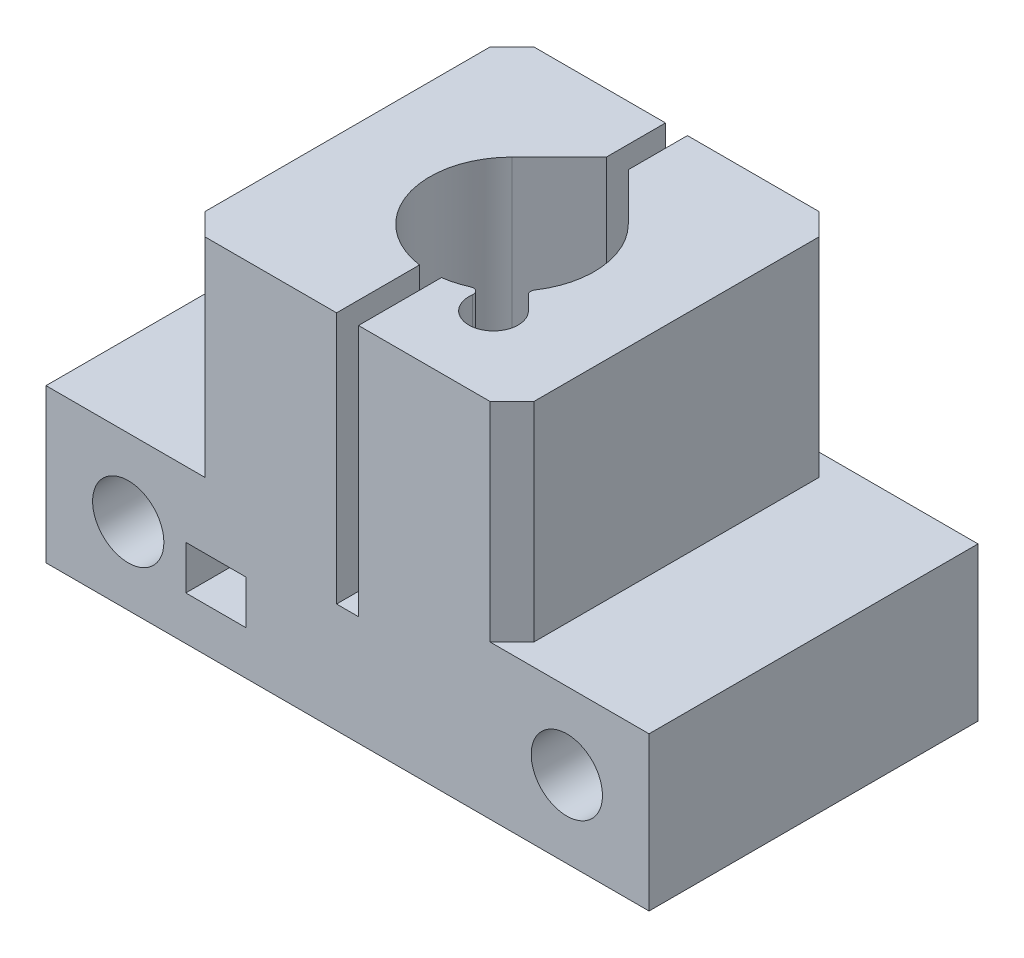
from build123d import *

# Parameters (mm, degrees)
SKETCH1_R           = 3.25
BOSS_EXTRUDE1_DEPTH = 15
CUT_EXTRUDE1_DEPTH  = 46.5
CUT_EXTRUDE2_DEPTH  = 24
CHAMFER1_SIZE       = 2
CUT_EXTRUDE4_DEPTH  = 20
SKETCH7_W           = 5.5
SKETCH7_H           = 4
CUT_EXTRUDE5_DEPTH  = 53.395133362
CUT_EXTRUDE6_DEPTH  = 24
CUT_EXTRUDE7_DEPTH  = 46.5


with BuildPart() as part:
    # Sketch1 → Boss-Extrude1 (new, symmetric)
    with BuildSketch(Plane.XY):
        Polygon((-27.5, 0), (27.5, 0), (27.5, 14), (15, 14), (15, 33), (1, 33), (1, 10), (-1, 10), (-1, 33), (-15, 33), (-15, 14), (-27.5, 14), align=None)
        with Locations((-20, 7)):
            Circle(SKETCH1_R, mode=Mode.SUBTRACT)
        with Locations((20, 7)):
            Circle(SKETCH1_R, mode=Mode.SUBTRACT)
    extrude(amount=BOSS_EXTRUDE1_DEPTH, both=True)

    # Sketch2 → Cut-Extrude1 (cut, through all)
    with BuildSketch(Plane(origin=(0, 33, 0), x_dir=(1, 0, 0), z_dir=(0, 1, 0))):
        with BuildLine():
            Line((-3.535533906, 3.535533906), (0, 7.071067812))
            Line((0, 7.071067812), (3.535533906, 3.535533906))
            ThreePointArc((3.535533906, 3.535533906), (0, -5), (-3.535533906, 3.535533906))
        make_face()
    extrude(amount=-CUT_EXTRUDE1_DEPTH, mode=Mode.SUBTRACT)

    # Sketch3 → Cut-Extrude2 (cut)
    with BuildSketch(Plane(origin=(0, 33, 0), x_dir=(1, 0, 0), z_dir=(0, 1, 0))):
        with BuildLine():
            Line((-5.303300859, 5.303300859), (0, 10.606601718))
            Line((0, 10.606601718), (5.303300859, 5.303300859))
            ThreePointArc((5.303300859, 5.303300859), (0, -7.5), (-5.303300859, 5.303300859))
        make_face()
    extrude(amount=-CUT_EXTRUDE2_DEPTH, mode=Mode.SUBTRACT)

    # Chamfer1
    chamfer1_edges = [part.edges().sort_by_distance(p)[0] for p in [
        (-15, 23.5, -15),
        (15, 23.5, -15),
        (15, 23.5, 15),
        (-15, 23.5, 15),
    ]]
    chamfer(chamfer1_edges, length=CHAMFER1_SIZE)

    # Sketch6 → Cut-Extrude4 (cut)
    with BuildSketch(Plane(origin=(0, 0, 0), x_dir=(-1, 0, 0), z_dir=(0, -1, 0))):
        with BuildLine():
            Line((13.237436867, -8.262563133), (12, -7.025126266))
            Line((12, -7.025126266), (10.762563133, -8.262563133))
            ThreePointArc((10.762563133, -8.262563133), (12, -11.25), (13.237436867, -8.262563133))
        make_face()
        with BuildLine():
            Line((13.237436867, 10.737436867), (12, 11.974873734))
            Line((12, 11.974873734), (10.762563133, 10.737436867))
            ThreePointArc((10.762563133, 10.737436867), (12, 7.75), (13.237436867, 10.737436867))
        make_face()
    extrude(amount=-CUT_EXTRUDE4_DEPTH, mode=Mode.SUBTRACT)

    # Sketch7 → Cut-Extrude5 (cut, through all)
    with BuildSketch(Plane.XY.offset(15)):
        with Locations((-12, 6)):
            Rectangle(SKETCH7_W, SKETCH7_H)
    extrude(amount=-CUT_EXTRUDE5_DEPTH, mode=Mode.SUBTRACT)

    # Sketch8 → Cut-Extrude6 (cut)
    with BuildSketch(Plane(origin=(0, 33, 0), x_dir=(1, 0, 0), z_dir=(0, 1, 0))):
        with BuildLine():
            Line((4.513018654, -5.990213905), (5.990213905, -4.513018654))
            Line((5.990213905, -4.513018654), (6.234774853, -4.168642769))
            ThreePointArc((6.234774853, -4.168642769), (6.152826818, -4.495486402), (6.296873119, -4.800105678))
            Line((6.296873119, -4.800105678), (7.590990258, -6.094222817))
            ThreePointArc((7.590990258, -6.094222817), (6.712115884, -9.819549264), (3.772434085, -7.368274449))
            ThreePointArc((3.772434085, -7.368274449), (3.57802416, -6.8982979), (3.072580722, -6.841728415))
            Line((3.072580722, -6.841728415), (4.513018654, -5.990213905))
        make_face()
    extrude(amount=-CUT_EXTRUDE6_DEPTH, mode=Mode.SUBTRACT)

    # Sketch9 → Cut-Extrude7 (cut, through all)
    with BuildSketch(Plane(origin=(0, 33, 0), x_dir=(1, 0, 0), z_dir=(0, 1, 0))):
        with BuildLine():
            Line((4.409009742, -6.094222817), (6, -4.503232559))
            Line((6, -4.503232559), (7.590990258, -6.094222817))
            ThreePointArc((7.590990258, -6.094222817), (6, -9.935213074), (4.409009742, -6.094222817))
        make_face()
    extrude(amount=-CUT_EXTRUDE7_DEPTH, mode=Mode.SUBTRACT)


solid = part.part
